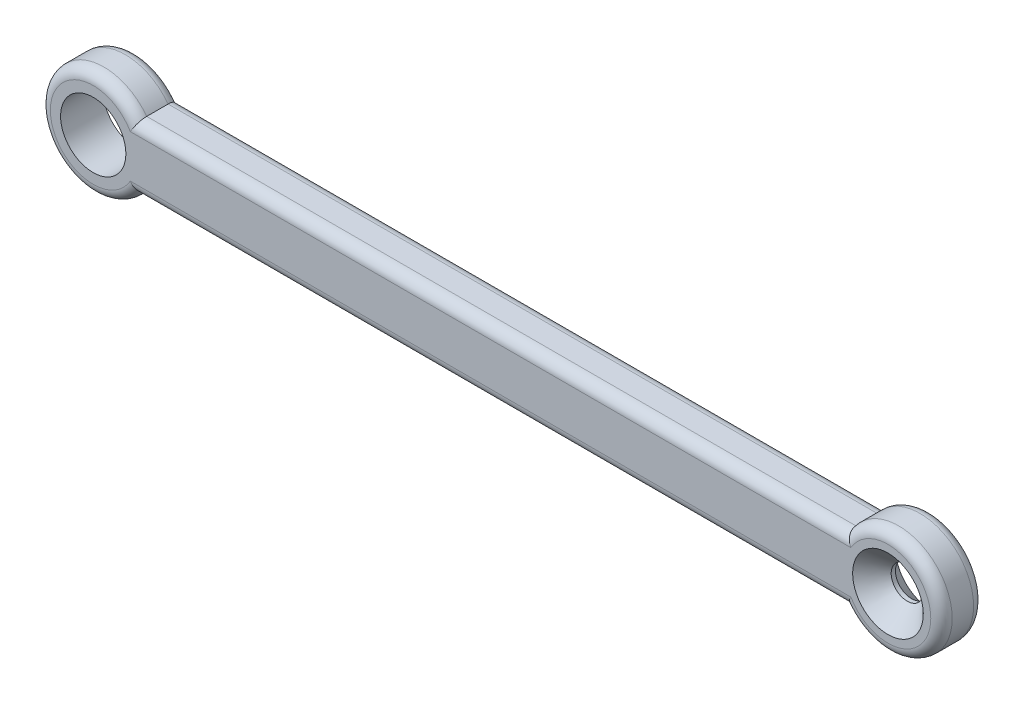
from build123d import *

# Parameters (mm, degrees)
BOSS_EXTRU_1_DEPTH              = 4
DIAM_TRE_DU_PER_AGE_6_1_6_1_1_D = 6.1
CONG_1_R                        = 1


with BuildPart() as part:
    # Esquisse1 → Boss.-Extru.1 (new body)
    with BuildSketch(Plane(origin=(0, 2, 0), x_dir=(1, 0, 0), z_dir=(0, 0, -1))):
        with BuildLine():
            Line((-33.125, -1), (33.125, -1))
            ThreePointArc((33.125, -1), (42.125, 2), (33.125, 5))
            Line((33.125, 5), (-33.125, 5))
            ThreePointArc((-33.125, 5), (-42.125, 2), (-33.125, -1))
        make_face()
    extrude(amount=-BOSS_EXTRU_1_DEPTH)

    # Diamètre du perçage Ø6.1 (6.1)1 (through all)
    with Locations(Plane(origin=(0, 0, 4), x_dir=(-1, 0, 0), z_dir=(0, 0, 1))):
        with Locations((37.125, 0)):
            Hole(DIAM_TRE_DU_PER_AGE_6_1_6_1_1_D / 2)

    # Esquisse4 → Fraisage pour vis à tête fraisée M2.51 (revolve, cut)
    with BuildSketch(Plane(origin=(37.125, 0, 4), x_dir=(0, -1, 0), z_dir=(1, 0, 0))):
        Polygon((0, 0), (0, 4), (3.3, 4), (1.5, 2.2), (1.5, 1.8), (3.3, 0), align=None)
    revolve(axis=Axis((37.125, 0, 10.35), (0, 0, -1)), mode=Mode.SUBTRACT)

    # Congé1
    cong_1_edges = [part.edges().sort_by_distance(p)[0] for p in [
        (42.125, 0, 4),
        (0, -3, 4),
        (-42.125, 0, 4),
        (0, -3, 0),
        (42.125, 0, 0),
        (0, 3, 0),
        (-42.125, 0, 0),
        (0, 3, 4),
    ]]
    fillet(cong_1_edges, radius=CONG_1_R)


solid = part.part
